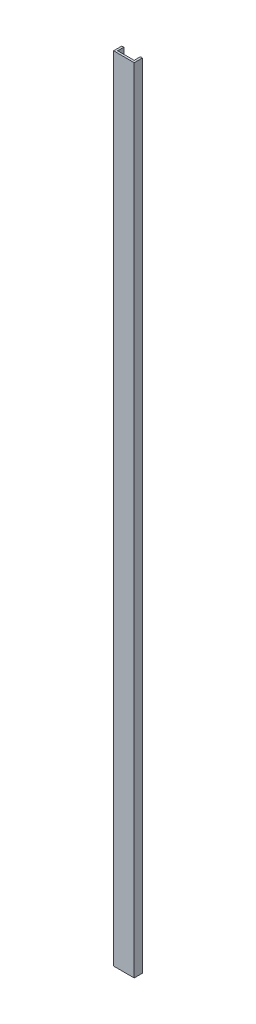
from build123d import *

# Parameters (mm, degrees)
BOSS_EXTRUDE1_DEPTH = 1219.2


with BuildPart() as part:
    # Sketch1 → Boss-Extrude1 (new body)
    with BuildSketch(Plane(origin=(0, 0, 0), x_dir=(1, 0, 0), z_dir=(0, 1, 0))):
        Polygon((3.175, 3.175), (3.175, 12.7), (0, 12.7), (0, 0), (31.75, 0), (31.75, 12.7), (28.575, 12.7), (28.575, 3.175), align=None)
    extrude(amount=BOSS_EXTRUDE1_DEPTH)


solid = part.part
